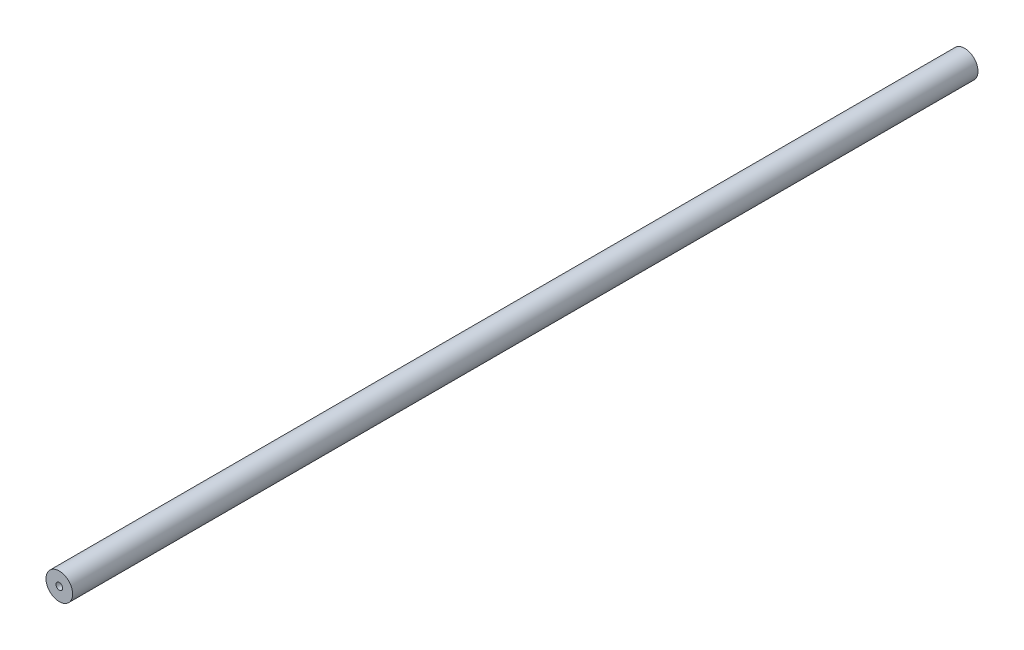
from build123d import *

# Parameters (mm, degrees)
SKETCH1_R           = 12.7
BOSS_EXTRUDE1_DEPTH = 863.6
SKETCH2_R           = 3.175
CUT_EXTRUDE1_DEPTH  = 863.6


with BuildPart() as part:
    # Sketch1 → Boss-Extrude1 (new body)
    with BuildSketch(Plane.XY):
        Circle(SKETCH1_R)
    extrude(amount=BOSS_EXTRUDE1_DEPTH)

    # Sketch2 → Cut-Extrude1 (cut)
    with BuildSketch(Plane.XY.offset(863.6)):
        Circle(SKETCH2_R)
    extrude(amount=-CUT_EXTRUDE1_DEPTH, mode=Mode.SUBTRACT)


solid = part.part
